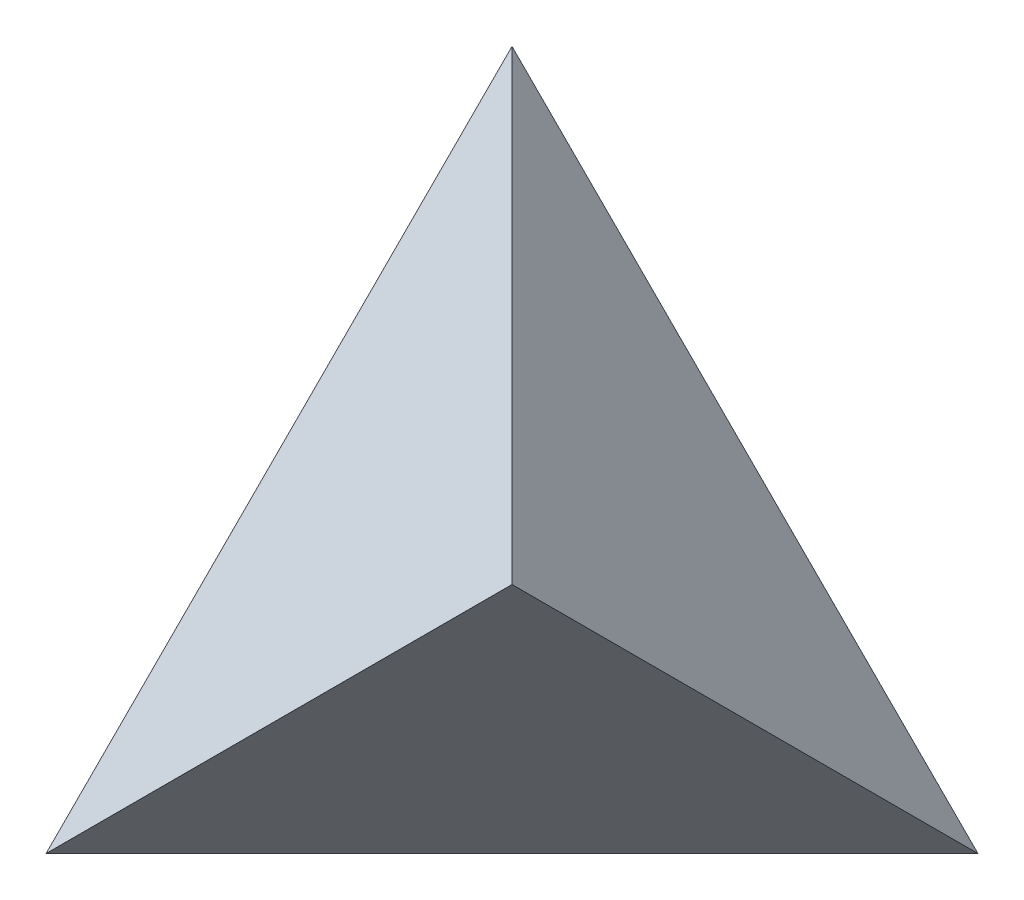
from build123d import *

# Parameters (mm, degrees)
CIRPATTERN2_2_ANGLE   = 180
CIRPATTERN2_2_5_ANGLE = 180


with BuildPart() as body_1:
    # Sketch12 → Surface-Plane4: a flat surface bounded by the sketch
    with BuildSketch(Plane(origin=(-2.886739258, -2.886739258, -2.886739258), x_dir=(0.4082482904638632, 0.4082482904638626, -0.8164965809277261), z_dir=(0.5773502691896264, 0.5773502691896254, 0.5773502691896256)), mode=Mode.PRIVATE) as surface_plane4_1_region:
        Polygon((-14.142076406, 0), (7.071038203, -12.24739743), (7.071038203, 12.24739743), align=None)
    surface_plane4_1 = surface_plane4_1_region.sketch.faces()[0]
    # CirPattern2: a copy of that surface (a pattern of surface bodies)
    cirpattern2_2 = surface_plane4_1.rotate(Axis((0, 0, 0), (0, 1, 0)), CIRPATTERN2_2_ANGLE)
    # Sketch11 → Surface-Plane3: a flat surface bounded by the sketch
    with BuildSketch(Plane(origin=(2.886739258, 2.886739258, -2.886739258), x_dir=(0.40824829046386335, 0.4082482904638629, 0.8164965809277259), z_dir=(-0.577350269189626, -0.5773502691896255, 0.577350269189626)), mode=Mode.PRIVATE) as surface_plane3_3_region:
        Polygon((-7.071038203, -12.24739743), (14.142076406, 0), (-7.071038203, 12.24739743), align=None)
    surface_plane3_3 = surface_plane3_3_region.sketch.faces()[0]
    # Sketch11 → Surface-Plane3: a flat surface bounded by the sketch
    with BuildSketch(Plane(origin=(2.886739258, 2.886739258, -2.886739258), x_dir=(0.40824829046386335, 0.4082482904638629, 0.8164965809277259), z_dir=(-0.577350269189626, -0.5773502691896255, 0.577350269189626)), mode=Mode.PRIVATE) as surface_plane3_4_region:
        Polygon((-7.071038203, -12.24739743), (14.142076406, 0), (-7.071038203, 12.24739743), align=None)
    surface_plane3_4 = surface_plane3_4_region.sketch.faces()[0]
    # CirPattern2 2: a copy of that surface (a pattern of surface bodies)
    cirpattern2_2_5 = surface_plane3_4.rotate(Axis((0, 0, 0), (0, 1, 0)), CIRPATTERN2_2_5_ANGLE)
    # Sketch12 → Surface-Plane4: a flat surface bounded by the sketch
    with BuildSketch(Plane(origin=(-2.886739258, -2.886739258, -2.886739258), x_dir=(0.4082482904638632, 0.4082482904638626, -0.8164965809277261), z_dir=(0.5773502691896264, 0.5773502691896254, 0.5773502691896256)), mode=Mode.PRIVATE) as surface_plane4_6_region:
        Polygon((-14.142076406, 0), (7.071038203, -12.24739743), (7.071038203, 12.24739743), align=None)
    surface_plane4_6 = surface_plane4_6_region.sketch.faces()[0]
    # Surface-Knit2: the surfaces knitted into a closed skin and filled: a solid
    add(Solid(Shell(Face.sew_faces(cirpattern2_2.faces() + surface_plane3_3.faces() + cirpattern2_2_5.faces() + surface_plane4_6.faces())[0])))


solid = body_1.part
